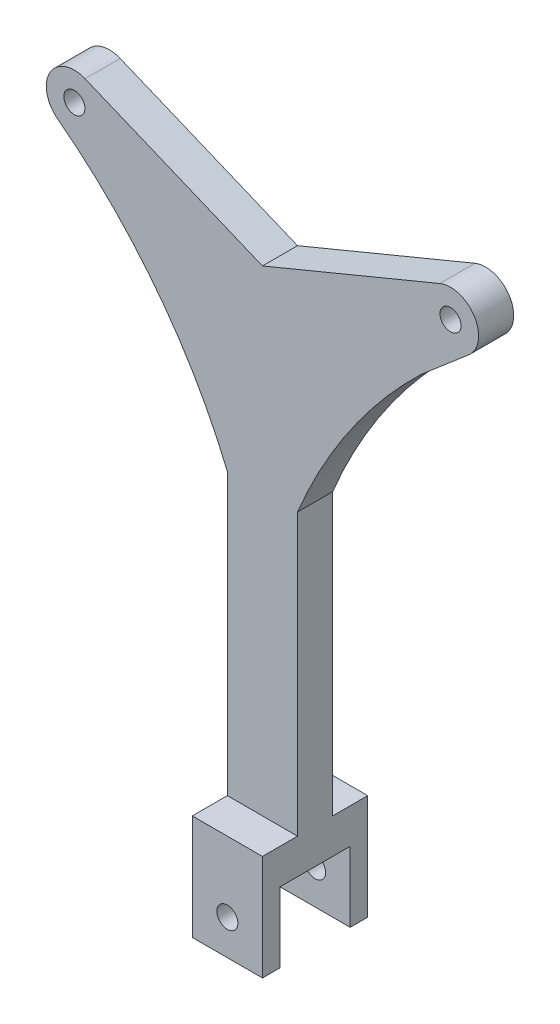
from build123d import *

# Parameters (mm, degrees)
Y_KSEKLIK_EKSTR_ZYON1_DEPTH = 2.5
IZIM2_R                     = 1.5
KES_EKSTR_ZYON1_DEPTH       = 11
IZIM3_W                     = 10
IZIM3_H                     = 15
Y_KSEKLIK_EKSTR_ZYON2_DEPTH = 15
IZIM4_W                     = 10
IZIM4_H                     = 10
KES_EKSTR_ZYON2_DEPTH       = 10
IZIM5_R                     = 1.5
KES_EKSTR_ZYON3_DEPTH       = 18


with BuildPart() as part:
    # Çizim1 → Yükseklik-Ekstrüzyon1 (new, symmetric)
    with BuildSketch(Plane.XY):
        with BuildLine():
            Line((22.660097643, 2.30045544), (29.392284146, 8.057892583))
            ThreePointArc((29.392284146, 8.057892583), (30.202384575, 13.188927169), (25.261772713, 14.793337669))
            Line((25.261772713, 14.793337669), (0, 4.329568801))
            Line((0, 4.329568801), (-25.261772713, 14.793337669))
            ThreePointArc((-25.261772713, 14.793337669), (-30.21464291, 13.168805295), (-29.356291498, 8.02747653))
            ThreePointArc((-29.356291498, 8.02747653), (-15.084034375, -6.132217103), (-5, -23.524931034))
            Line((-5, -23.524931034), (-5, -63.524931034))
            Line((-5, -63.524931034), (5, -63.524931034))
            Line((5, -63.524931034), (5, -23.524931034))
            ThreePointArc((5, -23.524931034), (12.493835858, -9.698499239), (22.660097643, 2.30045544))
        make_face()
    extrude(amount=Y_KSEKLIK_EKSTR_ZYON1_DEPTH, both=True)

    # Çizim2 → Kes-Ekstrüzyon1 (cut, symmetric)
    with BuildSketch(Plane.XY.offset(2.5)):
        with Locations((-26.792506443, 11.097819539)):
            Circle(IZIM2_R)
        with Locations((26.792506443, 11.097819539)):
            Circle(IZIM2_R)
    extrude(amount=KES_EKSTR_ZYON1_DEPTH, both=True, mode=Mode.SUBTRACT)

    # Çizim3 → Yükseklik-Ekstrüzyon2 (add)
    with BuildSketch(Plane.XZ.offset(63.524931034)):
        Rectangle(IZIM3_W, IZIM3_H)
    extrude(amount=Y_KSEKLIK_EKSTR_ZYON2_DEPTH)

    # Çizim4 → Kes-Ekstrüzyon2 (cut)
    with BuildSketch(Plane.XZ.offset(78.524931034)):
        Rectangle(IZIM4_W, IZIM4_H)
    extrude(amount=-KES_EKSTR_ZYON2_DEPTH, mode=Mode.SUBTRACT)

    # Çizim5 → Kes-Ekstrüzyon3 (cut)
    with BuildSketch(Plane.XY.offset(7.5)):
        with Locations((0, -73.524931034)):
            Circle(IZIM5_R)
    extrude(amount=-KES_EKSTR_ZYON3_DEPTH, mode=Mode.SUBTRACT)


solid = part.part
